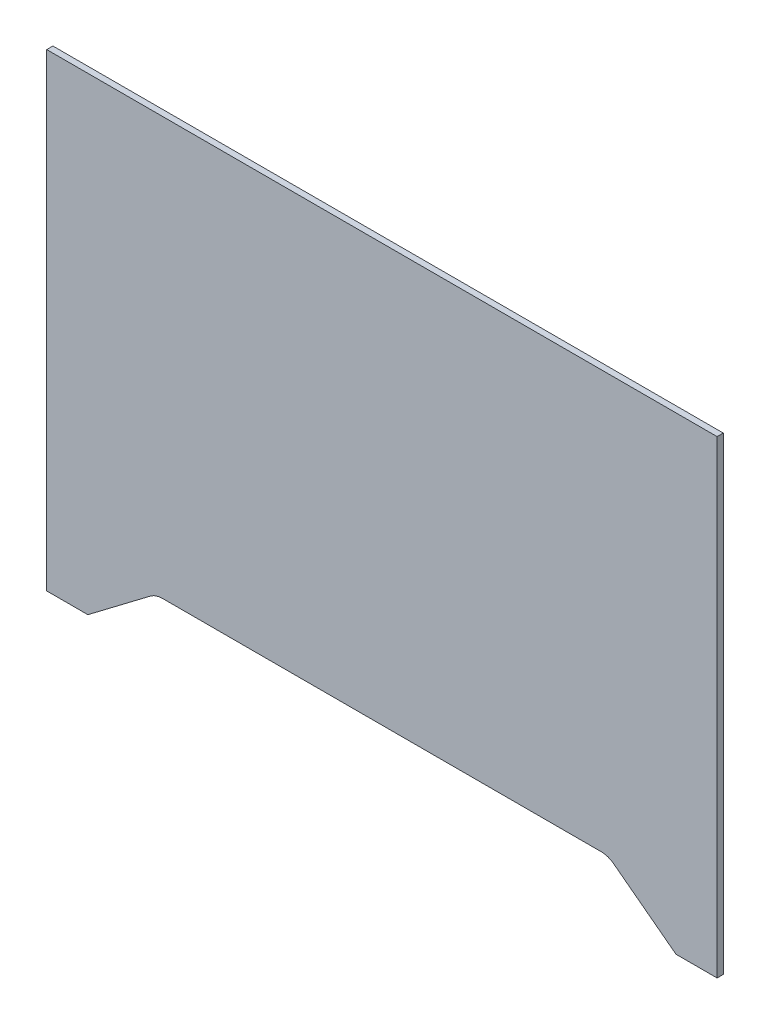
from build123d import *

# Parameters (mm, degrees)
BOSS_EXTRUDE1_DEPTH = 3


with BuildPart() as part:
    # Sketch1 → Boss-Extrude1 (new body)
    with BuildSketch(Plane.XY):
        with BuildLine():
            Line((-163, -114), (-163, 114))
            Line((-163, 114), (163, 114))
            Line((163, 114), (163, -114))
            Line((163, -114), (143, -114))
            Line((143, -114), (112.678383644, -91.029078518))
            ThreePointArc((112.678383644, -91.029078518), (109.824990055, -89.520832979), (106.639806764, -89))
            Line((106.639806764, -89), (-106.639806764, -89))
            ThreePointArc((-106.639806764, -89), (-109.824990055, -89.520832979), (-112.678383644, -91.029078518))
            Line((-112.678383644, -91.029078518), (-143, -114))
            Line((-143, -114), (-163, -114))
        make_face()
    extrude(amount=BOSS_EXTRUDE1_DEPTH)


solid = part.part
